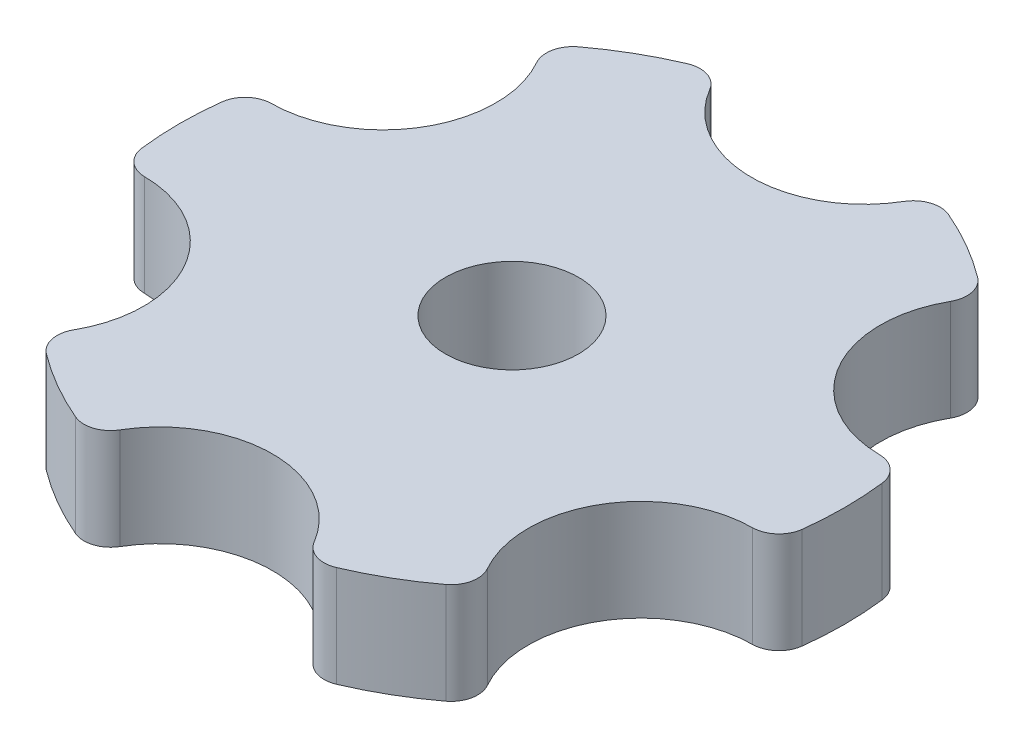
from build123d import *

# Parameters (mm, degrees)
SKETCH1_R           = 6.35
BOSS_EXTRUDE1_DEPTH = 9.652
FILLET1_R           = 2.54


with BuildPart() as part:
    # Sketch1 → Boss-Extrude1 (new body)
    with BuildSketch(Plane(origin=(0, 0, 0), x_dir=(1, 0, 0), z_dir=(0, 1, 0))):
        with BuildLine():
            ThreePointArc((-10.16, 30.080506977), (0, 22.86), (10.16, 30.080506977))
            ThreePointArc((10.16, 30.080506977), (15.875, 27.49630657), (20.970483201, 23.839071591))
            ThreePointArc((20.970483201, 23.839071591), (19.797340731, 11.43), (31.130483201, 6.241435386))
            ThreePointArc((31.130483201, 6.241435386), (31.75, 0), (31.130483201, -6.241435386))
            ThreePointArc((31.130483201, -6.241435386), (19.797340731, -11.43), (20.970483201, -23.839071591))
            ThreePointArc((20.970483201, -23.839071591), (15.875, -27.49630657), (10.16, -30.080506977))
            ThreePointArc((10.16, -30.080506977), (0, -22.86), (-10.16, -30.080506977))
            ThreePointArc((-10.16, -30.080506977), (-15.875, -27.49630657), (-20.970483201, -23.839071591))
            ThreePointArc((-20.970483201, -23.839071591), (-19.797340731, -11.43), (-31.130483201, -6.241435386))
            ThreePointArc((-31.130483201, -6.241435386), (-31.75, 0), (-31.130483201, 6.241435386))
            ThreePointArc((-31.130483201, 6.241435386), (-19.797340731, 11.43), (-20.970483201, 23.839071591))
            ThreePointArc((-20.970483201, 23.839071591), (-15.875, 27.49630657), (-10.16, 30.080506977))
        make_face()
        with Locations(Location((0, 0, 0), (0, 0, 270))):
            Circle(SKETCH1_R, mode=Mode.SUBTRACT)
    extrude(amount=BOSS_EXTRUDE1_DEPTH)

    # Fillet1
    fillet1_edges = [part.edges().sort_by_distance(p)[0] for p in [
        (-10.16, 4.826, -30.080506977),
        (10.16, 4.826, -30.080506977),
        (20.970483201, 4.826, -23.839071591),
        (31.130483201, 4.826, -6.241435386),
        (31.130483201, 4.826, 6.241435386),
        (20.970483201, 4.826, 23.839071591),
        (10.16, 4.826, 30.080506977),
        (-10.16, 4.826, 30.080506977),
        (-20.970483201, 4.826, 23.839071591),
        (-31.130483201, 4.826, 6.241435386),
        (-31.130483201, 4.826, -6.241435386),
        (-20.970483201, 4.826, -23.839071591),
    ]]
    fillet(fillet1_edges, radius=FILLET1_R)


solid = part.part
